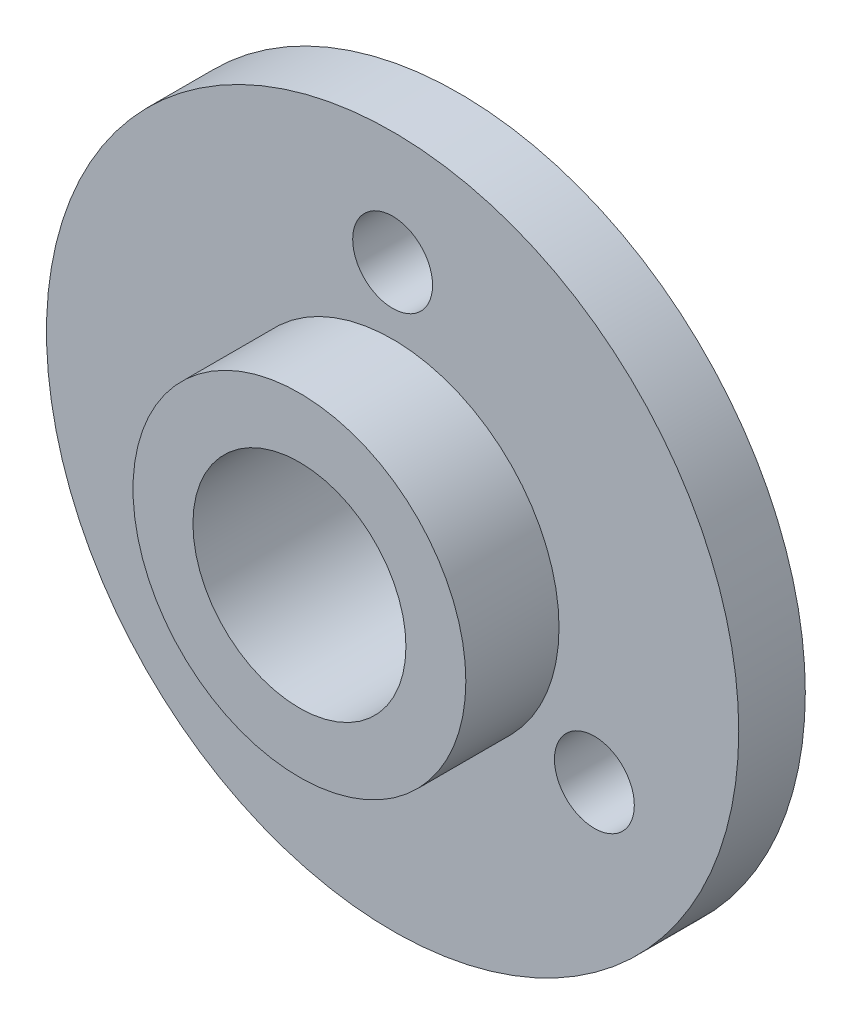
from build123d import *

# Parameters (mm, degrees)
SKETCH1_R           = 26
SKETCH1_R_2         = 12.5
BOSS_EXTRUDE1_DEPTH = 5
SKETCH1_3_R         = 12.5
SKETCH1_3_R_2       = 8
BOSS_EXTRUDE2_DEPTH = 12
SKETCH2_R           = 3
CUT_EXTRUDE1_DEPTH  = 39.678159212


with BuildPart() as part:
    # Sketch1 → Boss-Extrude1 (new body)
    with BuildSketch(Plane.XY):
        Circle(SKETCH1_R)
        Circle(SKETCH1_R_2, mode=Mode.SUBTRACT)
    extrude(amount=BOSS_EXTRUDE1_DEPTH)

    # Sketch1<3> → Boss-Extrude2 (add)
    with BuildSketch(Plane.XY):
        Circle(SKETCH1_3_R)
        Circle(SKETCH1_3_R_2, mode=Mode.SUBTRACT)
    extrude(amount=BOSS_EXTRUDE2_DEPTH)

    # Sketch2 → Cut-Extrude1 (cut, through all)
    with BuildSketch(Plane(origin=(0, 0, 0), x_dir=(-1, 0, 0), z_dir=(0, 0, -1))):
        with Locations((0, 17.5)):
            Circle(SKETCH2_R)
        with Locations((15.155444566, -8.75)):
            Circle(SKETCH2_R)
        with Locations((-15.155444566, -8.75)):
            Circle(SKETCH2_R)
    extrude(amount=-CUT_EXTRUDE1_DEPTH, mode=Mode.SUBTRACT)


solid = part.part
